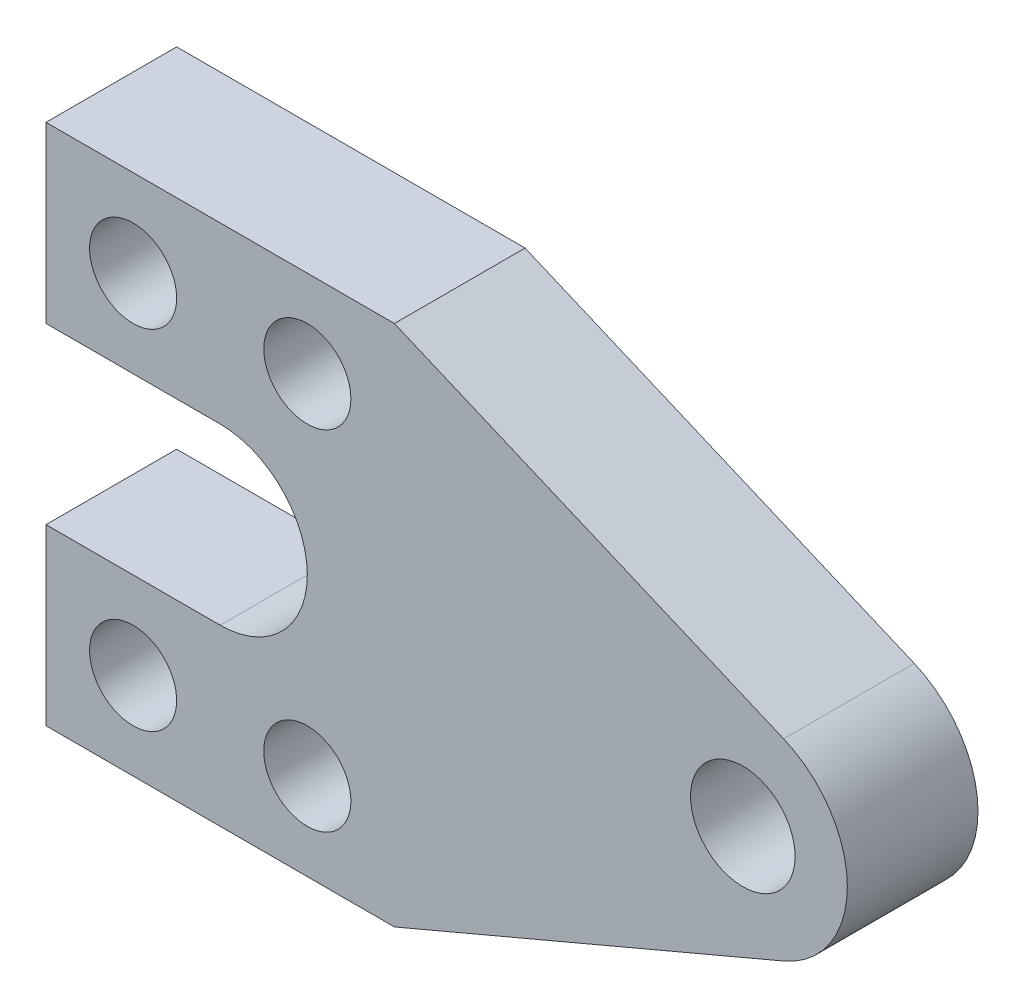
from build123d import *

# Parameters (mm, degrees)
SKETCH1_R           = 6
SKETCH1_R_2         = 5
BOSS_EXTRUDE1_DEPTH = 15


with BuildPart() as part:
    # Sketch1 → Boss-Extrude1 (new body)
    with BuildSketch(Plane.XY):
        with BuildLine():
            Line((-80, 30), (-40, 30))
            Line((-40, 30), (4.685564793, 11.047419724))
            ThreePointArc((4.685564793, 11.047419724), (12, 0), (4.685564793, -11.047419724))
            Line((4.685564793, -11.047419724), (-40, -30))
            Line((-40, -30), (-80, -30))
            Line((-80, -30), (-80, -10))
            Line((-80, -10), (-60, -10))
            ThreePointArc((-60, -10), (-50, 0), (-60, 10))
            Line((-60, 10), (-80, 10))
            Line((-80, 10), (-80, 30))
        make_face()
        Circle(SKETCH1_R, mode=Mode.SUBTRACT)
        with Locations((-70, 20)):
            Circle(SKETCH1_R_2, mode=Mode.SUBTRACT)
        with Locations((-50, 20)):
            Circle(SKETCH1_R_2, mode=Mode.SUBTRACT)
        with Locations(Location((-70, -20, 0), (0, 0, 180))):
            Circle(SKETCH1_R_2, mode=Mode.SUBTRACT)
        with Locations(Location((-50, -20, 0), (0, 0, 180))):
            Circle(SKETCH1_R_2, mode=Mode.SUBTRACT)
    extrude(amount=BOSS_EXTRUDE1_DEPTH)


solid = part.part
